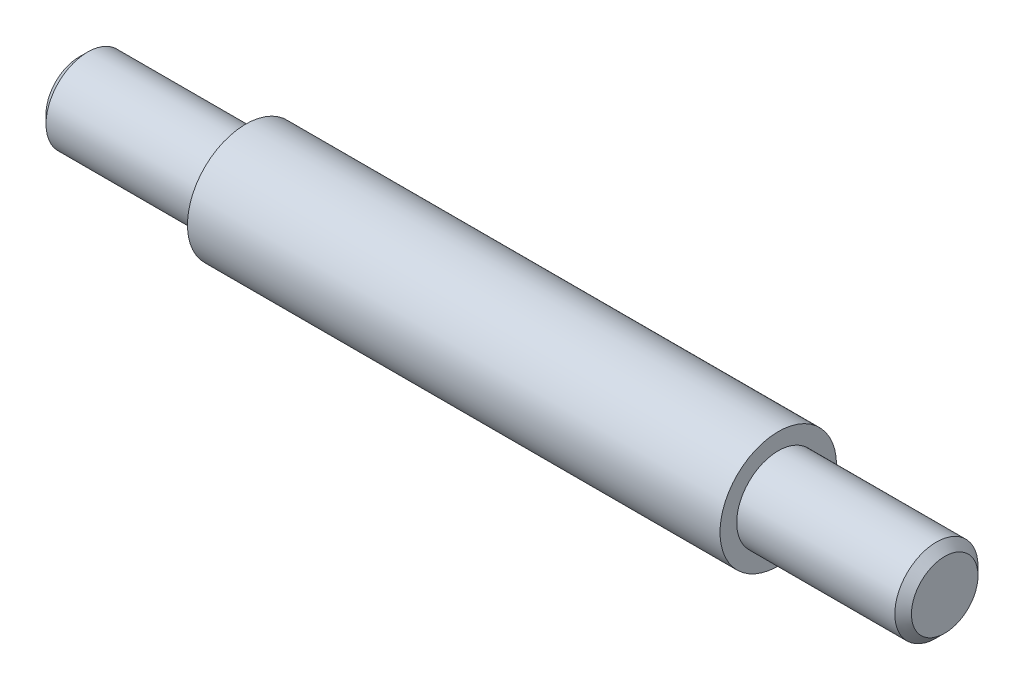
from build123d import *

# Parameters (mm, degrees)
SCHIZZO1_R                   = 3.5
ESTRUSIONE_ESTRUSIONE1_DEPTH = 16
SCHIZZO2_R                   = 2.5
ESTRUSIONE_ESTRUSIONE2_DEPTH = 10
ESTRUSIONE_ESTRUSIONE3_START = 10
SCHIZZO3_R                   = 2.5
ESTRUSIONE_ESTRUSIONE3_DEPTH = 10
SMUSSO1_SIZE                 = 0.5


with BuildPart() as part:
    # Schizzo1 → Estrusione-Estrusione1 (new, symmetric)
    with BuildSketch(Plane(origin=(0, 0, 0), x_dir=(0, 0, -1), z_dir=(1, 0, 0))):
        with Locations((-80, 0)):
            Circle(SCHIZZO1_R)
    extrude(amount=ESTRUSIONE_ESTRUSIONE1_DEPTH, both=True)

    # Schizzo2 → Estrusione-Estrusione2 (add)
    with BuildSketch(Plane(origin=(16, 0, 0), x_dir=(0, 0, -1), z_dir=(1, 0, 0))):
        with Locations((-80, 0)):
            Circle(SCHIZZO2_R)
    extrude(amount=ESTRUSIONE_ESTRUSIONE2_DEPTH)

    # Schizzo3 → Estrusione-Estrusione3 (add)
    with BuildSketch(Plane.ZY.offset(16).offset(ESTRUSIONE_ESTRUSIONE3_START)):
        with Locations(Location((80, 0, 0), (0, 0, 180))):
            Circle(SCHIZZO3_R)
    extrude(amount=-ESTRUSIONE_ESTRUSIONE3_DEPTH)

    # Smusso1
    smusso1_edges = [part.edges().sort_by_distance(p)[0] for p in [
        (-26, 0, 82.5),
        (26, 0, 82.5),
    ]]
    chamfer(smusso1_edges, length=SMUSSO1_SIZE)


solid = part.part
